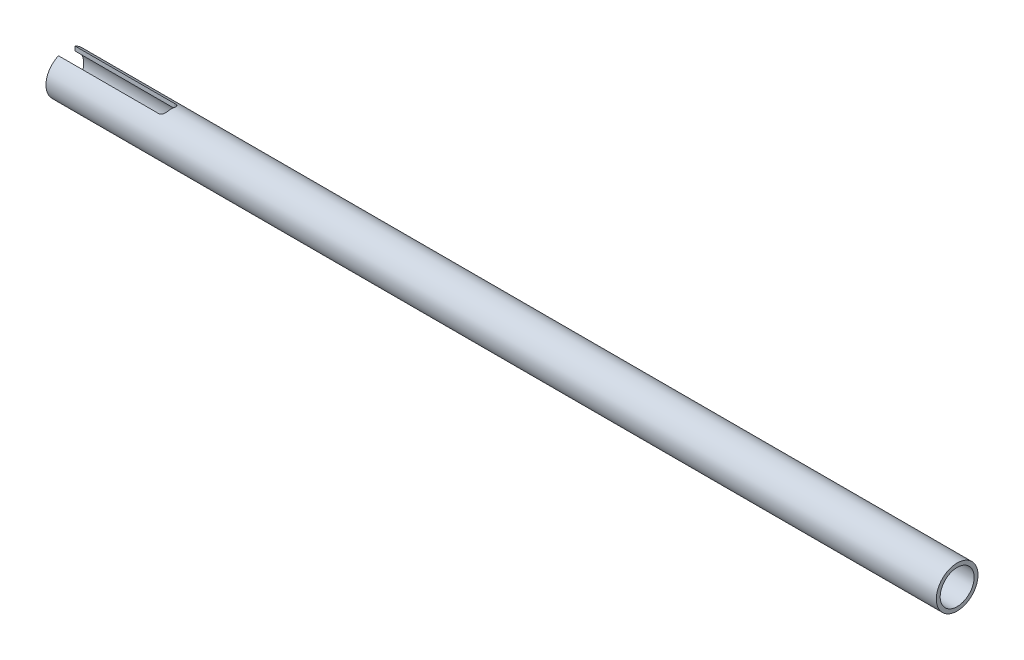
from build123d import *

# Parameters (mm, degrees)
BOSS_EXTRUDE1_DEPTH      = 192.925743
BOSS_EXTRUDE1_DEPTH_BACK = 146.220291
SKETCH1_R                = 7.9375
SKETCH1_R_2              = 6.4643
CUT_EXTRUDE1_DEPTH       = 331.187461377


with BuildPart() as part:
    # Sketch1 → Boss-Extrude1 (new, two sides: drawn at the far end of the back side and taken through both)
    with BuildSketch(Plane(origin=(0, 0, 0), x_dir=(0, 0, -1), z_dir=(1, 0, 0)).offset(-BOSS_EXTRUDE1_DEPTH_BACK)):
        with Locations(Location((0, 0, 0), (0, 0, 180))):
            Circle(SKETCH1_R)
        with Locations(Location((0, 0, 0), (0, 0, 180))):
            Circle(SKETCH1_R_2, mode=Mode.SUBTRACT)
    extrude(amount=BOSS_EXTRUDE1_DEPTH + BOSS_EXTRUDE1_DEPTH_BACK)

    # Sketch2 → Cut-Extrude1 (cut, through all)
    with BuildSketch(Plane(origin=(179.090362215, 7.9375, -46.327801352), x_dir=(0.11485518524691138, 0, -0.9933822458761269), z_dir=(0, 1, 0))):
        with BuildLine():
            Line((-86.538819377, 317.472174359), (-82.162836819, 279.624310791))
            ThreePointArc((-82.162836819, 279.624310791), (-81.572017256, 278.562611401), (-80.403509897, 278.229649083))
            Line((-80.403509897, 278.229649083), (-77.249521267, 278.594314296))
            ThreePointArc((-77.249521267, 278.594314296), (-76.187821877, 279.185133859), (-75.854859558, 280.353641218))
            Line((-75.854859558, 280.353641218), (-80.230842116, 318.201504786))
            Line((-80.230842116, 318.201504786), (-86.538819377, 317.472174359))
        make_face()
    extrude(amount=-CUT_EXTRUDE1_DEPTH, mode=Mode.SUBTRACT)


solid = part.part
